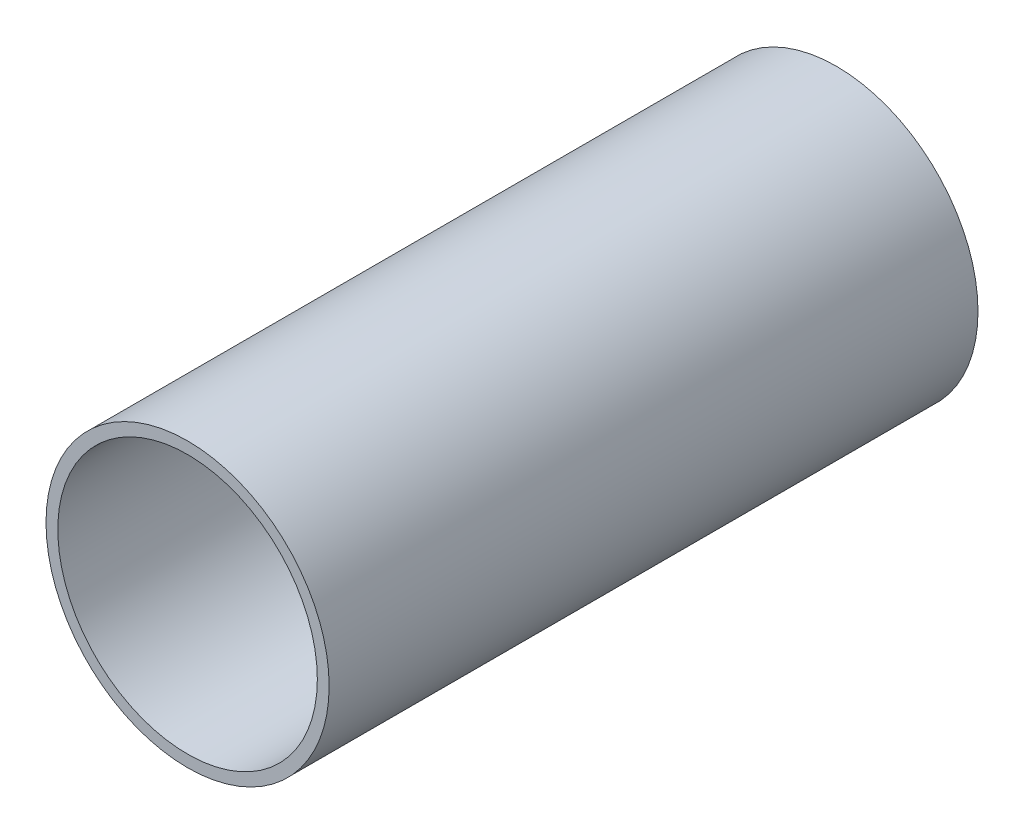
from build123d import *

# Parameters (mm, degrees)
SKETCH1_R           = 38.1
SKETCH1_R_2         = 34.925
BOSS_EXTRUDE1_DEPTH = 174.625


with BuildPart() as part:
    # Sketch1 → Boss-Extrude1 (new body)
    with BuildSketch(Plane.XY):
        Circle(SKETCH1_R)
        Circle(SKETCH1_R_2, mode=Mode.SUBTRACT)
    extrude(amount=BOSS_EXTRUDE1_DEPTH)


solid = part.part
